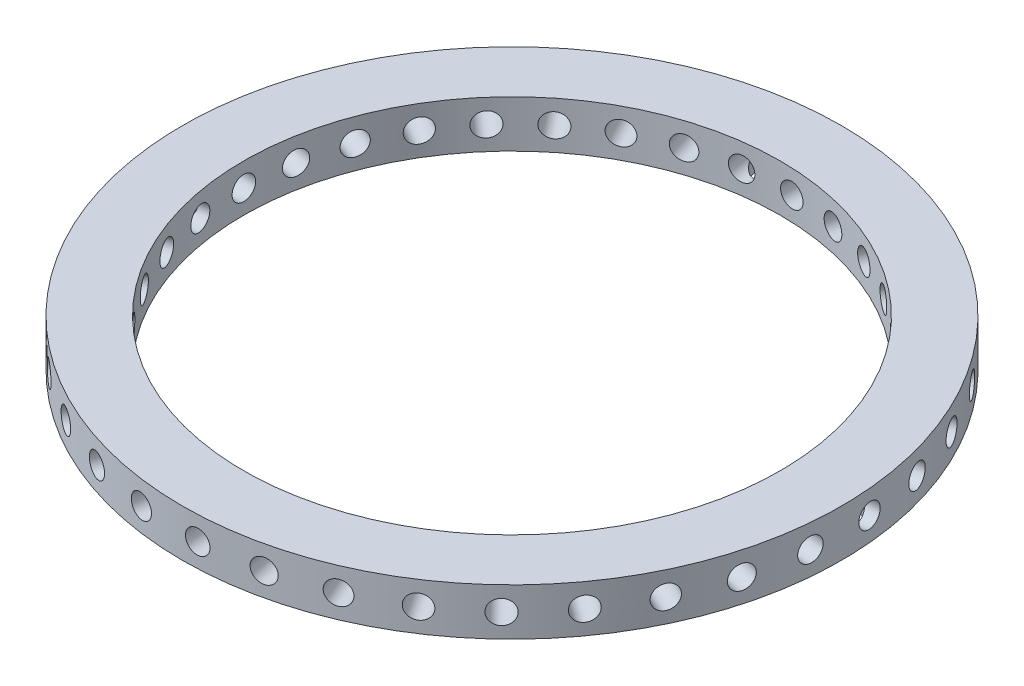
from build123d import *

# Parameters (mm, degrees)
CROQUIS2_R            = 1
CORTAR_EXTRUIR1_DEPTH = 10
MATRIZC1_COUNT        = 35
CROQUIS3_R            = 1.8
CORTAR_EXTRUIR2_DEPTH = 3.5


with BuildPart() as part:
    # Croquis1 → Revolución1 (revolve)
    with BuildSketch(Plane.XY, mode=Mode.PRIVATE) as revoluci_n1_sk:
        Polygon((-22.8, 0), (-28, 0), (-28, 1), (-28, 4), (-22.8, 4), align=None)
    revolve(revoluci_n1_sk.sketch.rotate(Axis((0, 0, 0), (0, 1, 0)), 270), axis=Axis((0, 0, 0), (0, 1, 0)))

    # Croquis2 → Cortar-Extruir1 (cut)
    with BuildSketch(Plane.ZY.offset(28)):
        with Locations(Location((0, 2, 0), (0, 0, 270))):
            Circle(CROQUIS2_R)
    cortar_extruir1 = extrude(amount=-CORTAR_EXTRUIR1_DEPTH, mode=Mode.SUBTRACT)

    # MatrizC1: Cortar-Extruir1 ×35 about axis
    matrizc1_axis = Axis((0, 0, 0), (0, -1, 0))
    for i in range(1, MATRIZC1_COUNT):
        add(cortar_extruir1.rotate(matrizc1_axis, i * 360 / MATRIZC1_COUNT), mode=Mode.SUBTRACT)

    # Croquis3 → Cortar-Extruir2 (cut)
    with BuildSketch(Plane.XZ):
        with Locations(Location((-25.082532104, 2.430346327, 0), (0, 0, 270))):
            Circle(CROQUIS3_R)
        with Locations(Location((2.430346327, 25.082532104, 0), (0, 0, 270))):
            Circle(CROQUIS3_R)
        with Locations(Location((25.082532104, -2.430346327, 0), (0, 0, 270))):
            Circle(CROQUIS3_R)
        with Locations(Location((-2.430346327, -25.082532104, 0), (0, 0, 270))):
            Circle(CROQUIS3_R)
    extrude(amount=-CORTAR_EXTRUIR2_DEPTH, mode=Mode.SUBTRACT)


solid = part.part
